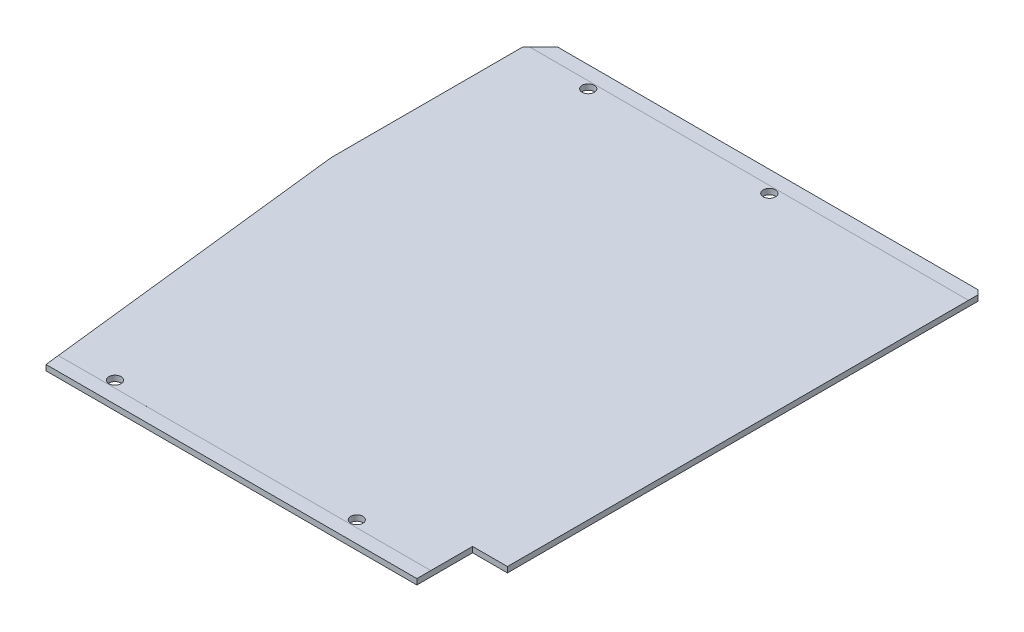
from build123d import *

# Parameters (mm, degrees)
SKETCH1_W               = 127
SKETCH1_H               = 152.4
BOSS_EXTRUDE1_DEPTH     = 1.6
CHAMFER1_SIZE           = 5
CHAMFER2_SIZE           = 1.27
SKETCH4_OUTSIDE_W       = 168.678
SKETCH4_OUTSIDE_H       = 194.078
SKETCH4_OUTSIDE_W_2     = 146.645454771
SKETCH4_OUTSIDE_H_2     = 144.4
CUT_EXTRUDE3_DEPTH      = 0.0001
CUT_EXTRUDE4_DEPTH      = 100.203074549
CUT_EXTRUDE4_DEPTH_BACK = 100.203074549
SKETCH7_W               = 10
SKETCH7_H               = 16
CUT_EXTRUDE7_DEPTH      = 10
CUT_EXTRUDE8_REACH      = 101.203
SKETCH9_R               = 1.75


with BuildPart() as part:
    # Sketch1 → Boss-Extrude1 (new body)
    with BuildSketch(Plane(origin=(0, 0, 0), x_dir=(1, 0, 0), z_dir=(0, 1, 0))):
        Rectangle(SKETCH1_W, SKETCH1_H)
    extrude(amount=BOSS_EXTRUDE1_DEPTH)

    # Chamfer1
    chamfer1_edges = [part.edges().sort_by_distance(p)[0] for p in [
        (-63.5, 0.8, 76.2),
        (-63.5, 0.8, -76.2),
    ]]
    chamfer(chamfer1_edges, length=CHAMFER1_SIZE)

    # Chamfer2
    chamfer2_edges = [part.edges().sort_by_distance(p)[0] for p in [
        (63.5, 0.8, 76.2),
        (63.5, 0.8, -76.2),
    ]]
    chamfer(chamfer2_edges, length=CHAMFER2_SIZE)

    # Sketch4 outside → Cut-Extrude3 (cut)
    with BuildSketch(Plane(origin=(0, 1.6, 0), x_dir=(-1, 0, 0), z_dir=(0, 1, 0))):
        Rectangle(SKETCH4_OUTSIDE_W, SKETCH4_OUTSIDE_H)
        with Locations((0.842207065, 0)):
            Rectangle(SKETCH4_OUTSIDE_W_2, SKETCH4_OUTSIDE_H_2, mode=Mode.SUBTRACT)
    extrude(amount=-CUT_EXTRUDE3_DEPTH, mode=Mode.SUBTRACT)

    # Sketch5 → Cut-Extrude4 (cut, two sides: drawn at the far end of the back side and taken through both)
    with BuildSketch(Plane(origin=(0, 1.6, 0), x_dir=(1, 0, 0), z_dir=(0, 1, 0)).offset(-CUT_EXTRUDE4_DEPTH_BACK)):
        Polygon((-8.552407118, -467.338817365), (-53, -76.2), (-63.5, 16.2), (-107.947592882, 407.338817365), (-890.225227612, 318.4436316), (-790.830041847, -556.23400313), align=None)
    extrude(amount=CUT_EXTRUDE4_DEPTH + CUT_EXTRUDE4_DEPTH_BACK, mode=Mode.SUBTRACT)

    # Sketch7 → Cut-Extrude7 (cut)
    with BuildSketch(Plane(origin=(0, 1.6, 0), x_dir=(1, 0, 0), z_dir=(0, 1, 0))):
        with Locations((58.5, -68.2)):
            Rectangle(SKETCH7_W, SKETCH7_H)
    extrude(amount=-CUT_EXTRUDE7_DEPTH, mode=Mode.SUBTRACT)

    # Sketch9 → Cut-Extrude8 (cut, up to next)
    with BuildSketch(Plane(origin=(0, 1.6, 0), x_dir=(1, 0, 0), z_dir=(0, 1, 0)), mode=Mode.PRIVATE) as cut_extrude8_sk1:
        with Locations(Location((-43.7, 70.2, 0), (0, 0, 270))):
            Circle(SKETCH9_R)
    cut_extrude8_tool1 = extrude(cut_extrude8_sk1.sketch, amount=-CUT_EXTRUDE8_REACH, mode=Mode.PRIVATE) & part.part
    # Sketch9 → Cut-Extrude8 (cut, up to next)
    with BuildSketch(Plane(origin=(0, 1.6, 0), x_dir=(1, 0, 0), z_dir=(0, 1, 0)), mode=Mode.PRIVATE) as cut_extrude8_sk2:
        with Locations(Location((8.3, 70.2, 0), (0, 0, 270))):
            Circle(SKETCH9_R)
    cut_extrude8_tool2 = extrude(cut_extrude8_sk2.sketch, amount=-CUT_EXTRUDE8_REACH, mode=Mode.PRIVATE) & part.part
    # Sketch9 → Cut-Extrude8 (cut, up to next)
    with BuildSketch(Plane(origin=(0, 1.6, 0), x_dir=(1, 0, 0), z_dir=(0, 1, 0)), mode=Mode.PRIVATE) as cut_extrude8_sk3:
        with Locations(Location((30.252, -70.2, 0), (0, 0, 270))):
            Circle(SKETCH9_R)
    cut_extrude8_tool3 = extrude(cut_extrude8_sk3.sketch, amount=-CUT_EXTRUDE8_REACH, mode=Mode.PRIVATE) & part.part
    # Sketch9 → Cut-Extrude8 (cut, up to next)
    with BuildSketch(Plane(origin=(0, 1.6, 0), x_dir=(1, 0, 0), z_dir=(0, 1, 0)), mode=Mode.PRIVATE) as cut_extrude8_sk4:
        with Locations(Location((-39.188, -70.2, 0), (0, 0, 270))):
            Circle(SKETCH9_R)
    cut_extrude8_tool4 = extrude(cut_extrude8_sk4.sketch, amount=-CUT_EXTRUDE8_REACH, mode=Mode.PRIVATE) & part.part
    add(cut_extrude8_tool1.solids().sort_by_distance((-43.7, 1.6, -70.2))[0], mode=Mode.SUBTRACT)
    add(cut_extrude8_tool2.solids().sort_by_distance((8.3, 1.6, -70.2))[0], mode=Mode.SUBTRACT)
    add(cut_extrude8_tool3.solids().sort_by_distance((30.252, 1.6, 70.2))[0], mode=Mode.SUBTRACT)
    add(cut_extrude8_tool4.solids().sort_by_distance((-39.188, 1.6, 70.2))[0], mode=Mode.SUBTRACT)


solid = part.part
